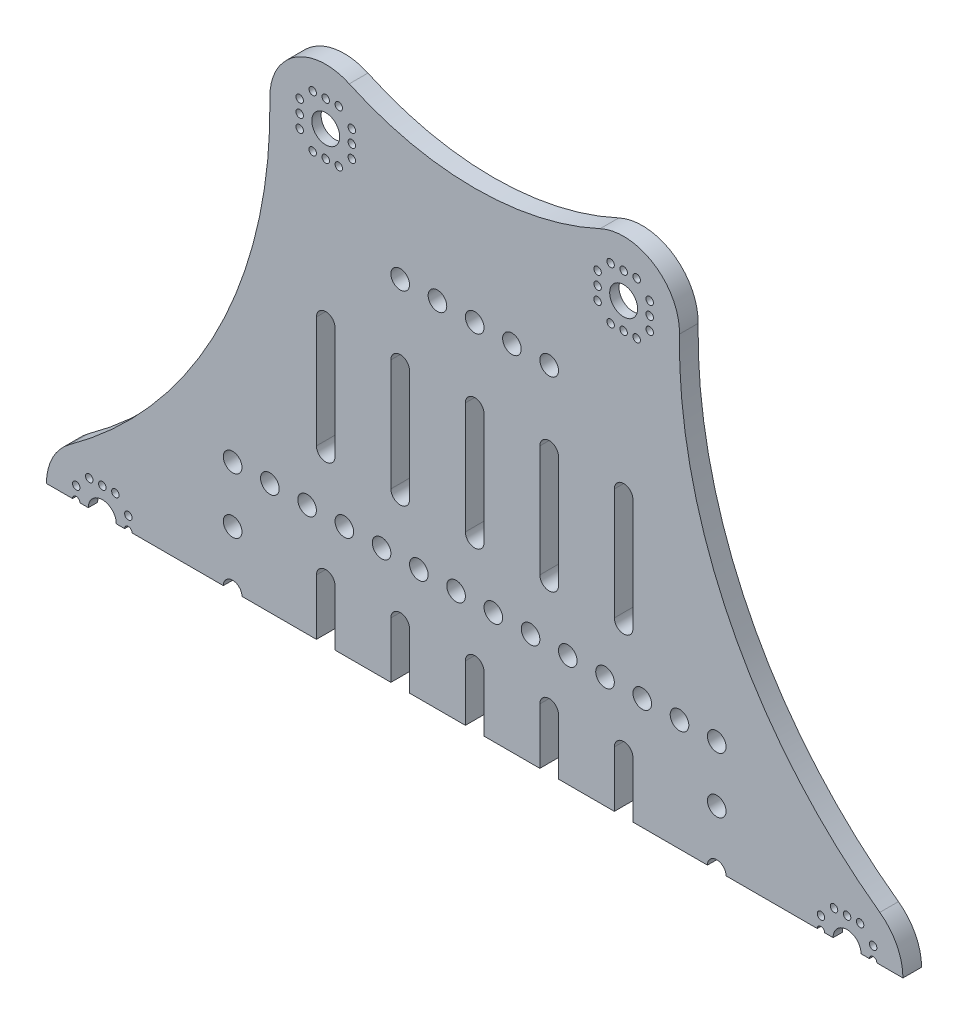
from build123d import *

# Parameters (mm, degrees)
BOSS_EXTRUDE1_DEPTH       = 5
SKETCH2_R                 = 11.25
CUT_EXTRUDE1_DEPTH        = 2.5
SKETCH3_R                 = 1
SKETCH3_R_2               = 3.75
CUT_EXTRUDE2_DEPTH        = 2.5
MIRROR2_COPY_1_SKETCH_R   = 1
MIRROR2_COPY_1_SKETCH_R_2 = 3.75
MIRROR2_COPY_1_DEPTH      = 2.5
SKETCH5_R                 = 2.5
CUT_EXTRUDE4_DEPTH        = 12.5
CUT_EXTRUDE6_DEPTH        = 10
SKETCH9_R                 = 2.5
CUT_EXTRUDE7_DEPTH        = 10
SKETCH10_R                = 2.5
CUT_EXTRUDE8_DEPTH        = 10
SKETCH11_W                = 230
SKETCH11_H                = 135
CUT_EXTRUDE9_DEPTH        = 10


with BuildPart() as part:
    # Sketch1 → Boss-Extrude1 (new body)
    with BuildSketch(Plane.XY):
        with BuildLine():
            ThreePointArc((108.79085436, -12.15404787), (115, 0), (108.79085436, 12.15404787))
            ThreePointArc((108.79085436, 12.15404787), (68.702723984, 59.351361992), (54.997750912, 119.740254766))
            ThreePointArc((54.997750912, 119.740254766), (48.179588548, 132.573556823), (33.684210526, 133.60554311))
            ThreePointArc((33.684210526, 133.60554311), (0, 126.168439698), (-33.684210526, 133.60554311))
            ThreePointArc((-33.684210526, 133.60554311), (-48.179588548, 132.573556823), (-54.997750912, 119.740254766))
            ThreePointArc((-54.997750912, 119.740254766), (-68.702723984, 59.351361992), (-108.79085436, 12.15404787))
            ThreePointArc((-108.79085436, 12.15404787), (-115, 0), (-108.79085436, -12.15404787))
            ThreePointArc((-108.79085436, -12.15404787), (-68.702723984, -59.351361992), (-54.997750912, -119.740254766))
            ThreePointArc((-54.997750912, -119.740254766), (-48.179588548, -132.573556823), (-33.684210526, -133.60554311))
            ThreePointArc((-33.684210526, -133.60554311), (0, -126.168439698), (33.684210526, -133.60554311))
            ThreePointArc((33.684210526, -133.60554311), (48.179588548, -132.573556823), (54.997750912, -119.740254766))
            ThreePointArc((54.997750912, -119.740254766), (68.702723984, -59.351361992), (108.79085436, -12.15404787))
        make_face()
    extrude(amount=BOSS_EXTRUDE1_DEPTH)

    # Sketch2 → Cut-Extrude1 (cut)
    with BuildSketch(Plane(origin=(0, 0, 0), x_dir=(-1, 0, 0), z_dir=(0, 0, -1))):
        with Locations((-40, 120)):
            Circle(SKETCH2_R)
        with Locations((-100, 0)):
            Circle(SKETCH2_R)
        with Locations((100, 0)):
            Circle(SKETCH2_R)
        with Locations((40, 120)):
            Circle(SKETCH2_R)
        with Locations((40, -120)):
            Circle(SKETCH2_R)
        with Locations((-40, -120)):
            Circle(SKETCH2_R)
    extrude(amount=-CUT_EXTRUDE1_DEPTH, mode=Mode.SUBTRACT)

    # Sketch3 → Cut-Extrude2 (cut)
    with BuildSketch(Plane(origin=(0, 0, 2.5), x_dir=(-1, 0, 0), z_dir=(0, 0, -1))):
        with Locations((-47, 123.5)):
            Circle(SKETCH3_R)
        with Locations((-47, 120)):
            Circle(SKETCH3_R)
        with Locations((-47, 116.5)):
            Circle(SKETCH3_R)
        with Locations((-40, 120)):
            Circle(SKETCH3_R_2)
        with Locations((-43.5, 113)):
            Circle(SKETCH3_R)
        with Locations((-40, 113)):
            Circle(SKETCH3_R)
        with Locations((-36.5, 113)):
            Circle(SKETCH3_R)
        with Locations((-33, 116.5)):
            Circle(SKETCH3_R)
        with Locations((-33, 120)):
            Circle(SKETCH3_R)
        with Locations((-33, 123.5)):
            Circle(SKETCH3_R)
        with Locations((-36.5, 127)):
            Circle(SKETCH3_R)
        with Locations((-40, 127)):
            Circle(SKETCH3_R)
        with Locations((-43.5, 127)):
            Circle(SKETCH3_R)
        with Locations((-100, -7)):
            Circle(SKETCH3_R)
        with Locations((-100, 0)):
            Circle(SKETCH3_R_2)
        with Locations((-93, 0)):
            Circle(SKETCH3_R)
        with Locations((-100, 0)):
            Circle(SKETCH3_R_2)
        with Locations((-100, 0)):
            Circle(SKETCH3_R_2)
        with Locations((-107, -3.5)):
            Circle(SKETCH3_R)
        with Locations((-107, 0)):
            Circle(SKETCH3_R)
        with Locations((-107, 3.5)):
            Circle(SKETCH3_R)
        with Locations((-103.5, 7)):
            Circle(SKETCH3_R)
        with Locations((-100, 7)):
            Circle(SKETCH3_R)
        with Locations((-96.5, 7)):
            Circle(SKETCH3_R)
        with Locations((-96.5, -7)):
            Circle(SKETCH3_R)
        with Locations((-103.5, -7)):
            Circle(SKETCH3_R)
        with Locations((-93, -3.5)):
            Circle(SKETCH3_R)
        with Locations((-93, 3.5)):
            Circle(SKETCH3_R)
    cut_extrude2 = extrude(amount=-CUT_EXTRUDE2_DEPTH, mode=Mode.SUBTRACT)

    # Mirror1: Cut-Extrude2 across plane
    add(cut_extrude2.mirror(Plane(origin=(0, 0, 0), x_dir=(0, 0, 1), z_dir=(1, 0, 0))), mode=Mode.SUBTRACT)

    # Mirror2: Cut-Extrude2 across plane
    add(cut_extrude2.mirror(Plane.ZX), mode=Mode.SUBTRACT)

    # Mirror2 copy 1 sketch → Mirror2 copy 1 (cut)
    with BuildSketch(Plane(origin=(0, 0, 2.5), x_dir=(1, 0, 0), z_dir=(0, 0, -1))):
        with Locations((-47, 123.5)):
            Circle(MIRROR2_COPY_1_SKETCH_R)
        with Locations((-47, 120)):
            Circle(MIRROR2_COPY_1_SKETCH_R)
        with Locations((-47, 116.5)):
            Circle(MIRROR2_COPY_1_SKETCH_R)
        with Locations((-40, 120)):
            Circle(MIRROR2_COPY_1_SKETCH_R_2)
        with Locations((-43.5, 113)):
            Circle(MIRROR2_COPY_1_SKETCH_R)
        with Locations((-40, 113)):
            Circle(MIRROR2_COPY_1_SKETCH_R)
        with Locations((-36.5, 113)):
            Circle(MIRROR2_COPY_1_SKETCH_R)
        with Locations((-33, 116.5)):
            Circle(MIRROR2_COPY_1_SKETCH_R)
        with Locations((-33, 120)):
            Circle(MIRROR2_COPY_1_SKETCH_R)
        with Locations((-33, 123.5)):
            Circle(MIRROR2_COPY_1_SKETCH_R)
        with Locations((-36.5, 127)):
            Circle(MIRROR2_COPY_1_SKETCH_R)
        with Locations((-40, 127)):
            Circle(MIRROR2_COPY_1_SKETCH_R)
        with Locations((-43.5, 127)):
            Circle(MIRROR2_COPY_1_SKETCH_R)
        with Locations((-100, -7)):
            Circle(MIRROR2_COPY_1_SKETCH_R)
        with Locations((-100, 0)):
            Circle(MIRROR2_COPY_1_SKETCH_R_2)
        with Locations((-93, 0)):
            Circle(MIRROR2_COPY_1_SKETCH_R)
        with Locations((-100, 0)):
            Circle(MIRROR2_COPY_1_SKETCH_R_2)
        with Locations((-100, 0)):
            Circle(MIRROR2_COPY_1_SKETCH_R_2)
        with Locations((-107, -3.5)):
            Circle(MIRROR2_COPY_1_SKETCH_R)
        with Locations((-107, 0)):
            Circle(MIRROR2_COPY_1_SKETCH_R)
        with Locations((-107, 3.5)):
            Circle(MIRROR2_COPY_1_SKETCH_R)
        with Locations((-103.5, 7)):
            Circle(MIRROR2_COPY_1_SKETCH_R)
        with Locations((-100, 7)):
            Circle(MIRROR2_COPY_1_SKETCH_R)
        with Locations((-96.5, 7)):
            Circle(MIRROR2_COPY_1_SKETCH_R)
        with Locations((-96.5, -7)):
            Circle(MIRROR2_COPY_1_SKETCH_R)
        with Locations((-103.5, -7)):
            Circle(MIRROR2_COPY_1_SKETCH_R)
        with Locations((-93, -3.5)):
            Circle(MIRROR2_COPY_1_SKETCH_R)
        with Locations((-93, 3.5)):
            Circle(MIRROR2_COPY_1_SKETCH_R)
    extrude(amount=-MIRROR2_COPY_1_DEPTH, mode=Mode.SUBTRACT)

    # Sketch5 → Cut-Extrude4 (cut)
    with BuildSketch(Plane(origin=(0, 0, 0), x_dir=(-1, 0, 0), z_dir=(0, 0, -1))):
        with Locations((20, 95)):
            Circle(SKETCH5_R)
        with Locations((0, 95)):
            Circle(SKETCH5_R)
        with Locations((10, 95)):
            Circle(SKETCH5_R)
        with Locations((10, -95)):
            Circle(SKETCH5_R)
        with Locations((0, -95)):
            Circle(SKETCH5_R)
        with Locations((20, -95)):
            Circle(SKETCH5_R)
        with Locations((-20, 95)):
            Circle(SKETCH5_R)
        with Locations((-10, 95)):
            Circle(SKETCH5_R)
        with Locations((-20, -95)):
            Circle(SKETCH5_R)
        with Locations((-10, -95)):
            Circle(SKETCH5_R)
    extrude(amount=-CUT_EXTRUDE4_DEPTH, mode=Mode.SUBTRACT)

    # Sketch8 → Cut-Extrude6 (cut)
    with BuildSketch(Plane.XY.offset(5)):
        with BuildLine():
            Line((42.5, 75), (42.5, 45))
            ThreePointArc((42.5, 45), (40, 42.5), (37.5, 45))
            Line((37.5, 45), (37.5, 75))
            ThreePointArc((37.5, 75), (40, 77.5), (42.5, 75))
        make_face()
        with BuildLine():
            Line((22.5, 75), (22.5, 45))
            ThreePointArc((22.5, 45), (20, 42.5), (17.5, 45))
            Line((17.5, 45), (17.5, 75))
            ThreePointArc((17.5, 75), (20, 77.5), (22.5, 75))
        make_face()
        with BuildLine():
            Line((2.5, 75), (2.5, 45))
            ThreePointArc((2.5, 45), (0, 42.5), (-2.5, 45))
            Line((-2.5, 45), (-2.5, 75))
            ThreePointArc((-2.5, 75), (0, 77.5), (2.5, 75))
        make_face()
        with BuildLine():
            Line((-17.5, 75), (-17.5, 45))
            ThreePointArc((-17.5, 45), (-20, 42.5), (-22.5, 45))
            Line((-22.5, 45), (-22.5, 75))
            ThreePointArc((-22.5, 75), (-20, 77.5), (-17.5, 75))
        make_face()
        with BuildLine():
            Line((-37.5, 75), (-37.5, 45))
            ThreePointArc((-37.5, 45), (-40, 42.5), (-42.5, 45))
            Line((-42.5, 45), (-42.5, 75))
            ThreePointArc((-42.5, 75), (-40, 77.5), (-37.5, 75))
        make_face()
        with BuildLine():
            Line((42.5, 15), (42.5, -15))
            ThreePointArc((42.5, -15), (40, -17.5), (37.5, -15))
            Line((37.5, -15), (37.5, 15))
            ThreePointArc((37.5, 15), (40, 17.5), (42.5, 15))
        make_face()
        with BuildLine():
            Line((22.5, 15), (22.5, -15))
            ThreePointArc((22.5, -15), (20, -17.5), (17.5, -15))
            Line((17.5, -15), (17.5, 15))
            ThreePointArc((17.5, 15), (20, 17.5), (22.5, 15))
        make_face()
        with BuildLine():
            Line((2.5, 15), (2.5, -15))
            ThreePointArc((2.5, -15), (0, -17.5), (-2.5, -15))
            Line((-2.5, -15), (-2.5, 15))
            ThreePointArc((-2.5, 15), (0, 17.5), (2.5, 15))
        make_face()
        with BuildLine():
            Line((-17.5, 15), (-17.5, -15))
            ThreePointArc((-17.5, -15), (-20, -17.5), (-22.5, -15))
            Line((-22.5, -15), (-22.5, 15))
            ThreePointArc((-22.5, 15), (-20, 17.5), (-17.5, 15))
        make_face()
        with BuildLine():
            Line((-37.5, 15), (-37.5, -15))
            ThreePointArc((-37.5, -15), (-40, -17.5), (-42.5, -15))
            Line((-42.5, -15), (-42.5, 15))
            ThreePointArc((-42.5, 15), (-40, 17.5), (-37.5, 15))
        make_face()
        with BuildLine():
            Line((42.5, -45), (42.5, -75))
            ThreePointArc((42.5, -75), (40, -77.5), (37.5, -75))
            Line((37.5, -75), (37.5, -45))
            ThreePointArc((37.5, -45), (40, -42.5), (42.5, -45))
        make_face()
        with BuildLine():
            Line((22.5, -45), (22.5, -75))
            ThreePointArc((22.5, -75), (20, -77.5), (17.5, -75))
            Line((17.5, -75), (17.5, -45))
            ThreePointArc((17.5, -45), (20, -42.5), (22.5, -45))
        make_face()
        with BuildLine():
            Line((2.5, -45), (2.5, -75))
            ThreePointArc((2.5, -75), (0, -77.5), (-2.5, -75))
            Line((-2.5, -75), (-2.5, -45))
            ThreePointArc((-2.5, -45), (0, -42.5), (2.5, -45))
        make_face()
        with BuildLine():
            Line((-17.5, -45), (-17.5, -75))
            ThreePointArc((-17.5, -75), (-20, -77.5), (-22.5, -75))
            Line((-22.5, -75), (-22.5, -45))
            ThreePointArc((-22.5, -45), (-20, -42.5), (-17.5, -45))
        make_face()
        with BuildLine():
            Line((-37.5, -45), (-37.5, -75))
            ThreePointArc((-37.5, -75), (-40, -77.5), (-42.5, -75))
            Line((-42.5, -75), (-42.5, -45))
            ThreePointArc((-42.5, -45), (-40, -42.5), (-37.5, -45))
        make_face()
    extrude(amount=-CUT_EXTRUDE6_DEPTH, mode=Mode.SUBTRACT)

    # Sketch9 → Cut-Extrude7 (cut)
    with BuildSketch(Plane.XY.offset(5)):
        with Locations((-65, 30)):
            Circle(SKETCH9_R)
        with Locations((-55, 30)):
            Circle(SKETCH9_R)
        with Locations((-45, 30)):
            Circle(SKETCH9_R)
        with Locations((-35, 30)):
            Circle(SKETCH9_R)
        with Locations((-25, 30)):
            Circle(SKETCH9_R)
        with Locations((-15, 30)):
            Circle(SKETCH9_R)
        with Locations((-5, 30)):
            Circle(SKETCH9_R)
        with Locations((5, 30)):
            Circle(SKETCH9_R)
        with Locations((15, 30)):
            Circle(SKETCH9_R)
        with Locations((25, 30)):
            Circle(SKETCH9_R)
        with Locations((35, 30)):
            Circle(SKETCH9_R)
        with Locations((45, 30)):
            Circle(SKETCH9_R)
        with Locations((55, 30)):
            Circle(SKETCH9_R)
        with Locations((65, 30)):
            Circle(SKETCH9_R)
        with Locations((65, -30)):
            Circle(SKETCH9_R)
        with Locations((55, -30)):
            Circle(SKETCH9_R)
        with Locations((45, -30)):
            Circle(SKETCH9_R)
        with Locations((35, -30)):
            Circle(SKETCH9_R)
        with Locations((25, -30)):
            Circle(SKETCH9_R)
        with Locations((15, -30)):
            Circle(SKETCH9_R)
        with Locations((5, -30)):
            Circle(SKETCH9_R)
        with Locations((-5, -30)):
            Circle(SKETCH9_R)
        with Locations((-15, -30)):
            Circle(SKETCH9_R)
        with Locations((-25, -30)):
            Circle(SKETCH9_R)
        with Locations((-35, -30)):
            Circle(SKETCH9_R)
        with Locations((-45, -30)):
            Circle(SKETCH9_R)
        with Locations((-55, -30)):
            Circle(SKETCH9_R)
        with Locations((-65, -30)):
            Circle(SKETCH9_R)
    extrude(amount=-CUT_EXTRUDE7_DEPTH, mode=Mode.SUBTRACT)

    # Sketch10 → Cut-Extrude8 (cut)
    with BuildSketch(Plane.XY.offset(5)):
        with Locations((-65, 0)):
            Circle(SKETCH10_R)
        with Locations((-65, 15)):
            Circle(SKETCH10_R)
        with Locations((-65, -15)):
            Circle(SKETCH10_R)
        with Locations((65, -15)):
            Circle(SKETCH10_R)
        with Locations((65, 0)):
            Circle(SKETCH10_R)
        with Locations((65, 15)):
            Circle(SKETCH10_R)
    extrude(amount=-CUT_EXTRUDE8_DEPTH, mode=Mode.SUBTRACT)

    # Sketch11 → Cut-Extrude9 (cut)
    with BuildSketch(Plane.XY.offset(5)):
        with Locations((0, -67.5)):
            Rectangle(SKETCH11_W, SKETCH11_H)
    extrude(amount=-CUT_EXTRUDE9_DEPTH, mode=Mode.SUBTRACT)


solid = part.part
